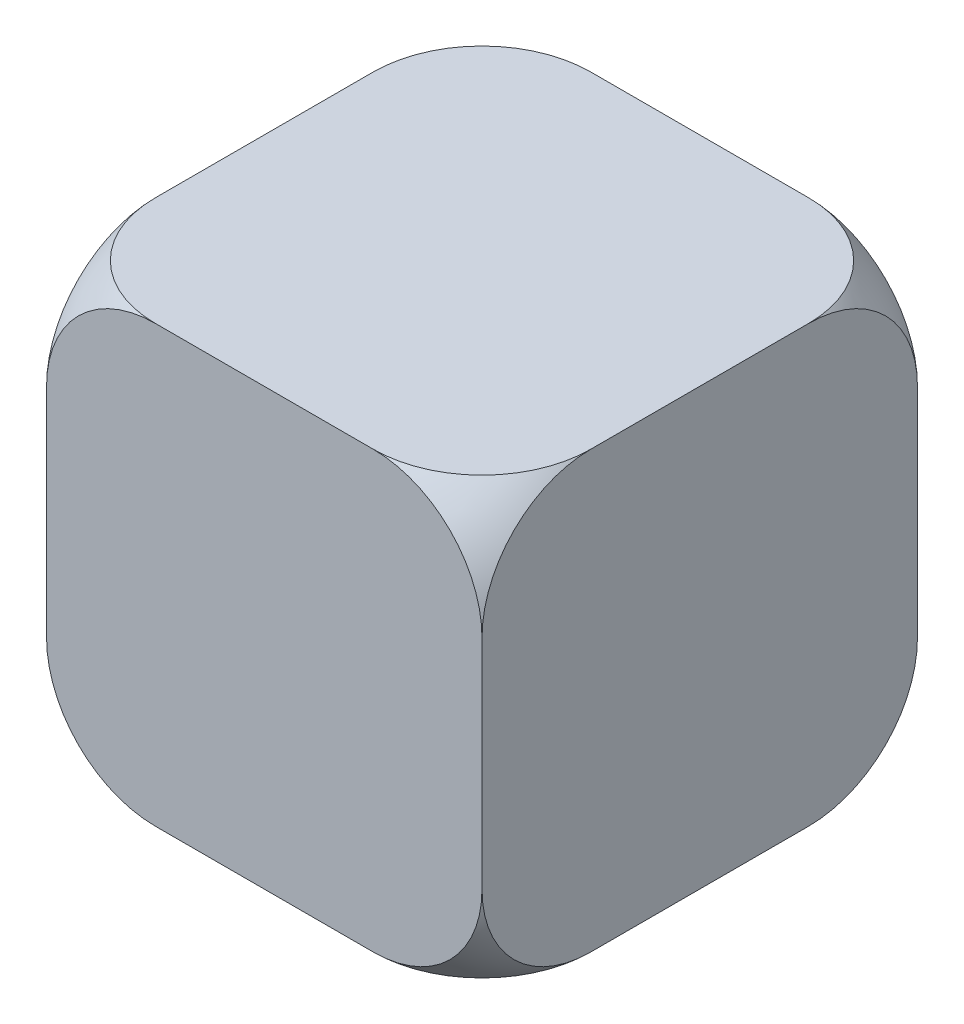
from build123d import *

# Parameters (mm, degrees)
PADR_O_LINEAR2_COUNT       = 2
PADR_O_LINEAR2_PITCH       = 5
PADR_O_LINEAR2_2_COUNT     = 2
PADR_O_LINEAR2_2_PITCH     = 5
CORTE_EXTRUS_O1_DEPTH      = 20.114105414
CORTE_EXTRUS_O1_DEPTH_BACK = 20.114105414
ESBO_O3_W                  = 20
ESBO_O3_H                  = 20
ESBO_O3_W_2                = 2.5
ESBO_O3_H_2                = 2.5
CORTE_EXTRUS_O3_DEPTH      = 20
CORTE_EXTRUS_O3_DEPTH_BACK = 10
ESBO_O4_W                  = 20
ESBO_O4_H                  = 20
ESBO_O4_W_2                = 2.5
ESBO_O4_H_2                = 2.5
ESBO_O5_W                  = 10
ESBO_O5_H                  = 10
RESSALTO_EXTRUS_O1_DEPTH   = 5
ESBO_O6_W                  = 10
ESBO_O6_H                  = 10
RESSALTO_EXTRUS_O2_DEPTH   = 5
ESBO_O7_W                  = 10
ESBO_O7_H                  = 10
RESSALTO_EXTRUS_O3_DEPTH   = 5


with BuildPart() as part:
    # Esboço2 → Revolução1 (revolve)
    with BuildSketch(Plane.XY.offset(2.5)):
        with BuildLine():
            Line((3.964466094, 2.5), (2.5, 2.5))
            Line((2.5, 2.5), (-1.035533906, 2.5))
            ThreePointArc((-1.035533906, 2.5), (1.14700975, -0.766407412), (5, 0))
            ThreePointArc((5, 0), (4.233592588, 1.14700975), (3.964466094, 2.5))
        make_face()
        with BuildLine():
            Line((6.035533906, 2.5), (3.964466094, 2.5))
            ThreePointArc((3.964466094, 2.5), (4.233592588, 1.14700975), (5, 0))
            ThreePointArc((5, 0), (5.766407412, 1.14700975), (6.035533906, 2.5))
        make_face()
        with BuildLine():
            ThreePointArc((6.035533906, 2.5), (5.766407412, 1.14700975), (5, 0))
            ThreePointArc((5, 0), (8.85299025, -0.766407412), (11.035533906, 2.5))
            Line((11.035533906, 2.5), (7.5, 2.5))
            Line((7.5, 2.5), (6.035533906, 2.5))
        make_face()
    revolve(axis=Axis((2.5, 2.5, 2.5), (-1, 0, 0)))


with BuildPart() as padr_o_linear2_1:
    # Padrão linear2: pattern copy
    add(part.part.moved(Location(Vector(0, 0, 1) * (1 * PADR_O_LINEAR2_PITCH))))


with BuildPart() as padr_o_linear2_2_1:
    # Padr_o linear2 2: pattern copy
    add(part.part.moved(Location(Vector(0, 1, 0) * (1 * PADR_O_LINEAR2_2_PITCH))))


with BuildPart() as padr_o_linear2_2_2:
    # Padr_o linear2 2: pattern copy
    add(padr_o_linear2_1.part.moved(Location(Vector(0, 1, 0) * (1 * PADR_O_LINEAR2_2_PITCH))))


with BuildPart() as corte_extrus_o1_tool:
    # Esboço3 → Corte-extrusão1 (new, two sides: drawn at the far end of the back side and taken through both)
    with BuildSketch(Plane.XY.offset(-CORTE_EXTRUS_O1_DEPTH_BACK)):
        with Locations((5, 5)):
            Rectangle(ESBO_O3_W, ESBO_O3_H)
        with Locations((1.25, 8.75)):
            Rectangle(ESBO_O3_W_2, ESBO_O3_H_2, mode=Mode.SUBTRACT)
        with Locations((1.25, 1.25)):
            Rectangle(ESBO_O3_W_2, ESBO_O3_H_2, mode=Mode.SUBTRACT)
        with Locations((8.75, 1.25)):
            Rectangle(ESBO_O3_W_2, ESBO_O3_H_2, mode=Mode.SUBTRACT)
        with Locations((8.75, 8.75)):
            Rectangle(ESBO_O3_W_2, ESBO_O3_H_2, mode=Mode.SUBTRACT)
    extrude(amount=CORTE_EXTRUS_O1_DEPTH + CORTE_EXTRUS_O1_DEPTH_BACK)


with BuildPart() as part_1:
    add(part.part)

    # Corte-extrusão1: cut by corte_extrus_o1_tool
    add(corte_extrus_o1_tool.part, mode=Mode.SUBTRACT)


with BuildPart() as padr_o_linear2_1_1:
    add(padr_o_linear2_1.part)

    # Corte-extrusão1: cut by corte_extrus_o1_tool
    add(corte_extrus_o1_tool.part, mode=Mode.SUBTRACT)


with BuildPart() as padr_o_linear2_2_1_1:
    add(padr_o_linear2_2_1.part)

    # Corte-extrusão1: cut by corte_extrus_o1_tool
    add(corte_extrus_o1_tool.part, mode=Mode.SUBTRACT)


with BuildPart() as padr_o_linear2_2_2_1:
    add(padr_o_linear2_2_2.part)

    # Corte-extrusão1: cut by corte_extrus_o1_tool
    add(corte_extrus_o1_tool.part, mode=Mode.SUBTRACT)


with BuildPart() as corte_extrus_o1_piece_1:
    # of the separate pieces the step leaves, piece 1, a body of its own (corte_extrus_o1_pieces)
    add(part_1.part.solids().sort_by_distance((0, 0, 2.5))[0])


with BuildPart() as corte_extrus_o1_piece_2:
    # of the separate pieces the step leaves, piece 2, a body of its own (corte_extrus_o1_pieces)
    add(part_1.part.solids().sort_by_distance((10, 2.5, 5))[0])


with BuildPart() as corte_extrus_o1_piece_1_of_padr_o_linear:
    # of the separate pieces the step leaves, piece 1, a body of its own (corte_extrus_o1_pieces_of_padr_o_linear2)
    add(padr_o_linear2_1_1.part.solids().sort_by_distance((0, 0, 7.5))[0])


with BuildPart() as corte_extrus_o1_piece_2_of_padr_o_linear:
    # of the separate pieces the step leaves, piece 2, a body of its own (corte_extrus_o1_pieces_of_padr_o_linear2)
    add(padr_o_linear2_1_1.part.solids().sort_by_distance((10, 2.5, 10))[0])


with BuildPart() as corte_extrus_o1_piece_1_of_padr_o_li_2:
    # of the separate pieces the step leaves, piece 1, a body of its own (corte_extrus_o1_pieces_of_padr_o_lin_2)
    add(padr_o_linear2_2_1_1.part.solids().sort_by_distance((0, 10, 2.5))[0])


with BuildPart() as corte_extrus_o1_piece_2_of_padr_o_li_2:
    # of the separate pieces the step leaves, piece 2, a body of its own (corte_extrus_o1_pieces_of_padr_o_lin_2)
    add(padr_o_linear2_2_1_1.part.solids().sort_by_distance((7.5, 7.5, 6.035533906))[0])


with BuildPart() as corte_extrus_o1_piece_1_of_padr_o_li_3:
    # of the separate pieces the step leaves, piece 1, a body of its own (corte_extrus_o1_pieces_of_padr_o_lin_3)
    add(padr_o_linear2_2_2_1.part.solids().sort_by_distance((0, 10, 7.5))[0])


with BuildPart() as corte_extrus_o1_piece_2_of_padr_o_li_3:
    # of the separate pieces the step leaves, piece 2, a body of its own (corte_extrus_o1_pieces_of_padr_o_lin_3)
    add(padr_o_linear2_2_2_1.part.solids().sort_by_distance((7.5, 7.5, 11.035533906))[0])


with BuildPart() as corte_extrus_o3_tool:
    # Esboço4 → Corte-extrusão3 (new, two sides: drawn at the far end of the back side and taken through both)
    with BuildSketch(Plane(origin=(0, 0, 0), x_dir=(0, 0, -1), z_dir=(1, 0, 0)).offset(-CORTE_EXTRUS_O3_DEPTH_BACK)):
        with Locations((-5, 5)):
            Rectangle(ESBO_O4_W, ESBO_O4_H)
        with Locations((-8.75, 8.75)):
            Rectangle(ESBO_O4_W_2, ESBO_O4_H_2, mode=Mode.SUBTRACT)
        with Locations((-1.25, 1.25)):
            Rectangle(ESBO_O4_W_2, ESBO_O4_H_2, mode=Mode.SUBTRACT)
        with Locations((-1.25, 8.75)):
            Rectangle(ESBO_O4_W_2, ESBO_O4_H_2, mode=Mode.SUBTRACT)
        with Locations((-8.75, 1.25)):
            Rectangle(ESBO_O4_W_2, ESBO_O4_H_2, mode=Mode.SUBTRACT)
    extrude(amount=CORTE_EXTRUS_O3_DEPTH + CORTE_EXTRUS_O3_DEPTH_BACK)


with BuildPart() as corte_extrus_o1_piece_1_1:
    add(corte_extrus_o1_piece_1.part)

    # Corte-extrusão3: cut by corte_extrus_o3_tool
    add(corte_extrus_o3_tool.part, mode=Mode.SUBTRACT)



with BuildPart() as corte_extrus_o1_piece_2_1:
    add(corte_extrus_o1_piece_2.part)

    # Corte-extrusão3: cut by corte_extrus_o3_tool
    add(corte_extrus_o3_tool.part, mode=Mode.SUBTRACT)


with BuildPart() as corte_extrus_o1_piece_1_of_padr_o_linear_1:
    add(corte_extrus_o1_piece_1_of_padr_o_linear.part)

    # Corte-extrusão3: cut by corte_extrus_o3_tool
    add(corte_extrus_o3_tool.part, mode=Mode.SUBTRACT)


with BuildPart() as corte_extrus_o1_piece_2_of_padr_o_linear_1:
    add(corte_extrus_o1_piece_2_of_padr_o_linear.part)

    # Corte-extrusão3: cut by corte_extrus_o3_tool
    add(corte_extrus_o3_tool.part, mode=Mode.SUBTRACT)


with BuildPart() as corte_extrus_o1_piece_1_of_padr_o_li_2_1:
    add(corte_extrus_o1_piece_1_of_padr_o_li_2.part)

    # Corte-extrusão3: cut by corte_extrus_o3_tool
    add(corte_extrus_o3_tool.part, mode=Mode.SUBTRACT)


with BuildPart() as corte_extrus_o1_piece_2_of_padr_o_li_2_1:
    add(corte_extrus_o1_piece_2_of_padr_o_li_2.part)

    # Corte-extrusão3: cut by corte_extrus_o3_tool
    add(corte_extrus_o3_tool.part, mode=Mode.SUBTRACT)


with BuildPart() as corte_extrus_o1_piece_1_of_padr_o_li_3_1:
    add(corte_extrus_o1_piece_1_of_padr_o_li_3.part)

    # Corte-extrusão3: cut by corte_extrus_o3_tool
    add(corte_extrus_o3_tool.part, mode=Mode.SUBTRACT)


with BuildPart() as corte_extrus_o1_piece_2_of_padr_o_li_3_1:
    add(corte_extrus_o1_piece_2_of_padr_o_li_3.part)

    # Corte-extrusão3: cut by corte_extrus_o3_tool
    add(corte_extrus_o3_tool.part, mode=Mode.SUBTRACT)


with BuildPart() as corte_extrus_o1_piece_1_2:
    add(corte_extrus_o1_piece_1_1.part)

    add(corte_extrus_o1_piece_2_1.part)  # Ressalto-extrusão1 merges Corte-extrusão1 piece 2

    add(corte_extrus_o1_piece_1_of_padr_o_linear_1.part)  # Ressalto-extrusão1 merges Corte-extrusão1 piece 1 of Padr_o linear

    add(corte_extrus_o1_piece_2_of_padr_o_linear_1.part)  # Ressalto-extrusão1 merges Corte-extrusão1 piece 2 of Padr_o linear

    add(corte_extrus_o1_piece_1_of_padr_o_li_2_1.part)  # Ressalto-extrusão1 merges Corte-extrusão1 piece 1 of Padr_o li 2

    add(corte_extrus_o1_piece_2_of_padr_o_li_2_1.part)  # Ressalto-extrusão1 merges Corte-extrusão1 piece 2 of Padr_o li 2

    add(corte_extrus_o1_piece_1_of_padr_o_li_3_1.part)  # Ressalto-extrusão1 merges Corte-extrusão1 piece 1 of Padr_o li 3

    add(corte_extrus_o1_piece_2_of_padr_o_li_3_1.part)  # Ressalto-extrusão1 merges Corte-extrusão1 piece 2 of Padr_o li 3
    # Esboço5 → Ressalto-extrusão1 (add)
    with BuildSketch(Plane.XY.offset(2.5)):
        with Locations((5, 5)):
            Rectangle(ESBO_O5_W, ESBO_O5_H)
    extrude(amount=RESSALTO_EXTRUS_O1_DEPTH)

    # Esboço6 → Ressalto-extrusão2 (add)
    with BuildSketch(Plane(origin=(2.5, 0, 0), x_dir=(0, 0, -1), z_dir=(1, 0, 0))):
        with Locations((-5, 5)):
            Rectangle(ESBO_O6_W, ESBO_O6_H)
    extrude(amount=RESSALTO_EXTRUS_O2_DEPTH)

    # Esboço7 → Ressalto-extrusão3 (add)
    with BuildSketch(Plane(origin=(0, 2.5, 0), x_dir=(1, 0, 0), z_dir=(0, 1, 0))):
        with Locations((5, -5)):
            Rectangle(ESBO_O7_W, ESBO_O7_H)
    extrude(amount=RESSALTO_EXTRUS_O3_DEPTH)


solid = corte_extrus_o1_piece_1_2.part
